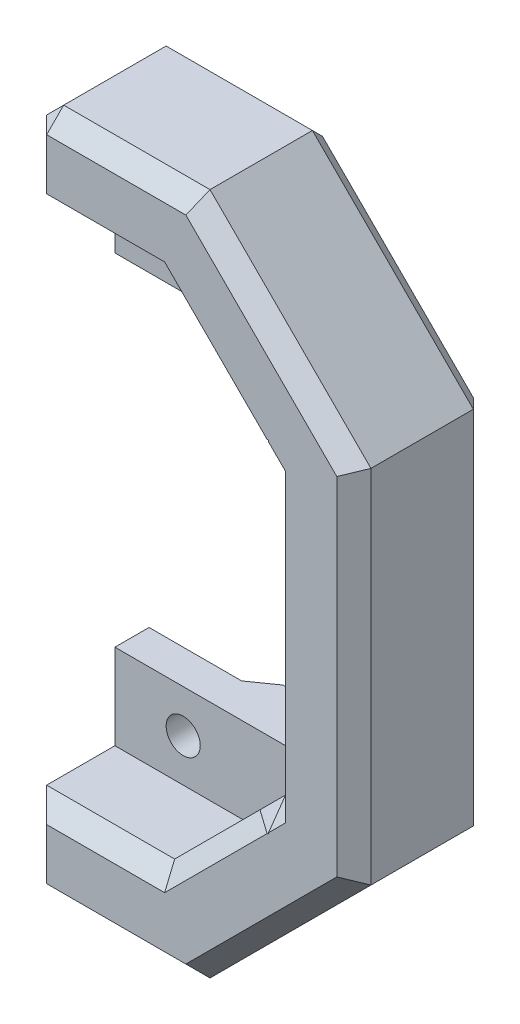
from build123d import *

# Parameters (mm, degrees)
EXTRUDE_1_DEPTH          = 3
EXTRUDE_2_DEPTH          = 5
SKETCH_4_R               = 1
CUT_EXTRUDE_1_DEPTH      = 8
CHAMFER_1_SIZE           = 1
CUT_EXTRUDE_3_DEPTH      = 26.690465157
CUT_EXTRUDE_3_DEPTH_BACK = 26.690465157


with BuildPart() as part:
    # 草图1 → 凸台-拉伸1 (new body)
    with BuildSketch(Plane.XY):
        Polygon((-5, -6.428932188), (-8.571067812, -10), (-14, -10), (-14, -15), (-6.5, -15), (0, -8.5), (0, 0), (0, 8.5), (-6.5, 15), (-14, 15), (-14, 10), (-8.571067812, 10), (-5, 6.428932188), (-5, 0), align=None)
        Polygon((-4.428932188, -20), (-14, -20), (-14, -15), (-6.5, -15), (0, -8.5), (0, 0), (0, 8.5), (-6.5, 15), (-14, 15), (-14, 20), (-4.428932188, 20), (5, 10.571067812), (5, 0), (5, -10.571067812), align=None)
    extrude(amount=EXTRUDE_1_DEPTH)

    # 草图3 → 凸台-拉伸2 (add)
    with BuildSketch(Plane.XY.offset(3)):
        Polygon((-14, -20), (-14, -15), (-6.5, -15), (0, -8.5), (0, 0), (0, 8.5), (-6.5, 15), (-14, 15), (-14, 20), (-4.428932188, 20), (5, 10.571067812), (5, 0), (5, -10.571067812), (-4.428932188, -20), align=None)
    extrude(amount=EXTRUDE_2_DEPTH)

    # 草图4 → 切除-拉伸1 (cut)
    with BuildSketch(Plane.XY.offset(3)):
        with Locations((-10, 12.5)):
            Circle(SKETCH_4_R)
        with Locations((-10, -12.5)):
            Circle(SKETCH_4_R)
    extrude(amount=-CUT_EXTRUDE_1_DEPTH, mode=Mode.SUBTRACT)

    # 倒角1
    chamfer_1_edges = [part.edges().sort_by_distance(p)[0] for p in [
        (-11.285533906, -10, 0),
        (-6.785533906, -8.214466094, 0),
        (-5, 0, 0),
        (-6.785533906, 8.214466094, 0),
        (-11.285533906, 10, 0),
        (-14, 15, 0),
        (-9.214466094, 20, 0),
        (0.285533906, 15.285533906, 0),
        (5, 0, 0),
        (0.285533906, -15.285533906, 0),
        (-9.214466094, -20, 0),
        (-14, -15, 0),
        (-14, 20, 4),
        (-14, -20, 4),
        (-9.214466094, -20, 8),
        (0.285533906, -15.285533906, 8),
        (5, 0, 8),
        (0.285533906, 15.285533906, 8),
        (-9.214466094, 20, 8),
        (-14, 17.5, 8),
        (-10.25, 15, 8),
        (-3.25, 11.75, 8),
        (0, 0, 8),
        (-3.25, -11.75, 8),
        (-10.25, -15, 8),
        (-14, -17.5, 8),
    ]]
    chamfer(chamfer_1_edges, length=CHAMFER_1_SIZE)

    # 草图6 → 切除-拉伸3 (cut, two sides: drawn at the far end of the back side and taken through both)
    with BuildSketch(Plane(origin=(0, 0, 0), x_dir=(-1, 0, 0), z_dir=(0, 0, -1)).offset(-CUT_EXTRUDE_3_DEPTH_BACK)):
        Polygon((84.424659409, 10), (8.571067812, 10), (0, 10), (0, -10), (8.571067812, -10), (84.424659409, -10), (236.131842603, -10), (236.131842603, 10), align=None)
    extrude(amount=CUT_EXTRUDE_3_DEPTH + CUT_EXTRUDE_3_DEPTH_BACK, mode=Mode.SUBTRACT)


solid = part.part
